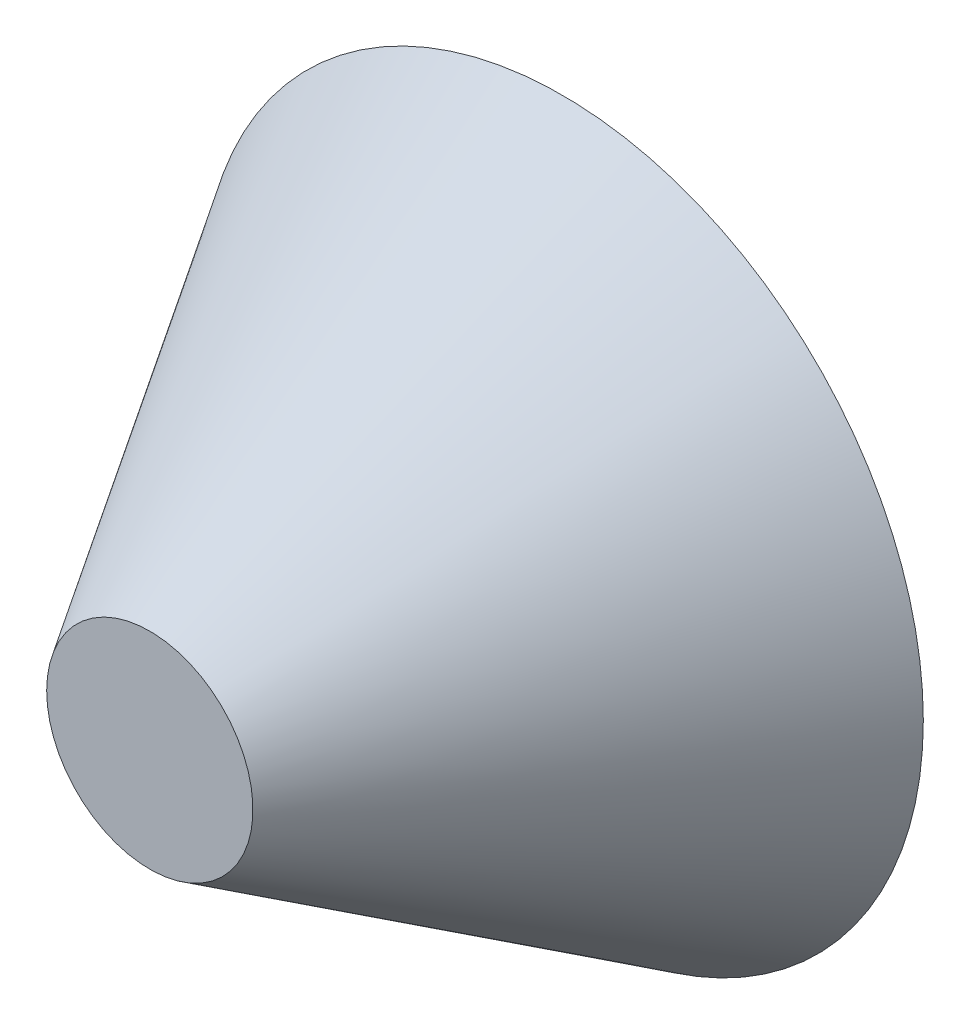
from build123d import *

# Parameters (mm, degrees)
SKETCH1_R = 444.5
SKETCH2_R = 127


with BuildPart() as part:
    # Sketch1 → Loft1 section 0
    with BuildSketch(Plane.XY):
        Circle(SKETCH1_R)
    # Sketch2 → Loft1 section 1
    with BuildSketch(Plane.XY.offset(508)):
        Circle(SKETCH2_R)
    loft()


solid = part.part
